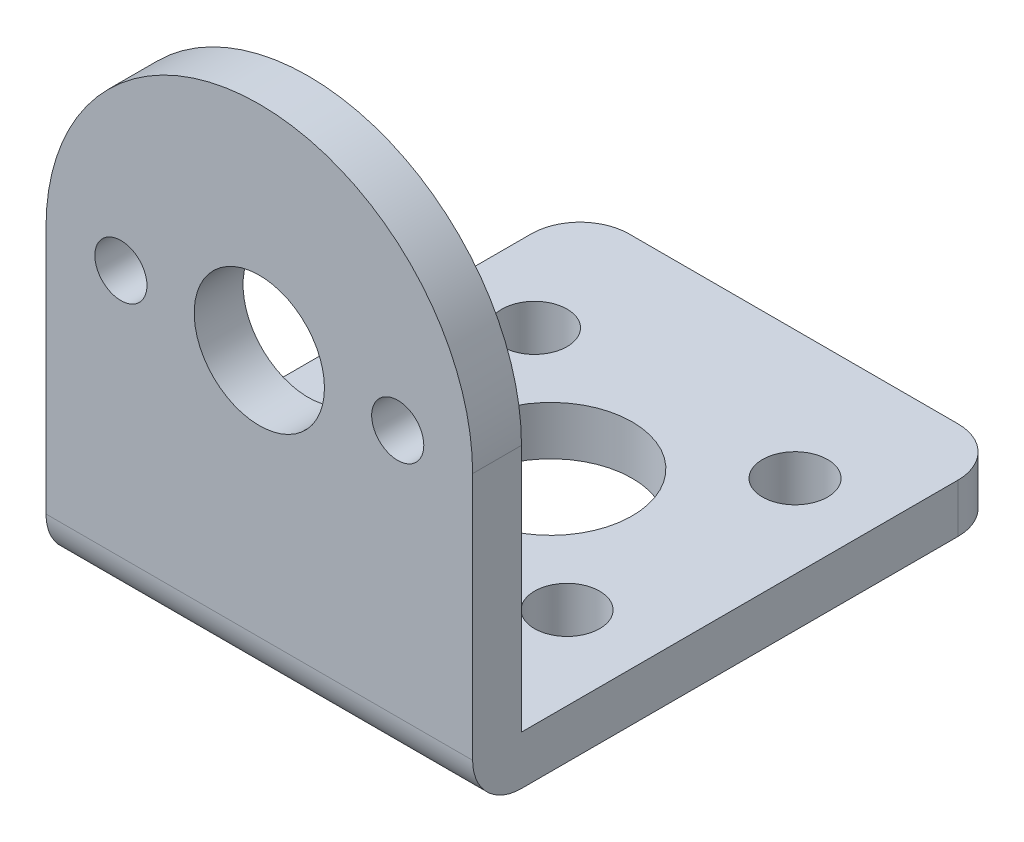
from build123d import *

# Parameters (mm, degrees)
SKETCH1_R            = 4
SKETCH1_R_2          = 1.6
JGA25_SCREWS_DEPTH   = 3
SKETCH2_W            = 26.2
SKETCH2_H            = 29.8
SKETCH2_R            = 5
SKETCH2_R_2          = 2
BRACKET_SCREWS_DEPTH = 3
L_SHAPE_FILLET_R     = 3
CORNER_FILLETS_R     = 3


with BuildPart() as part:
    # Sketch1 → JGA25-Screws (new body)
    with BuildSketch(Plane.XY):
        with BuildLine():
            Line((-13.1, 0), (-13.1, -18.25))
            Line((-13.1, -18.25), (13.1, -18.25))
            Line((13.1, -18.25), (13.1, 0))
            ThreePointArc((13.1, 0), (0, 13.1), (-13.1, 0))
        make_face()
        Circle(SKETCH1_R, mode=Mode.SUBTRACT)
        with Locations((-8.5, 0)):
            Circle(SKETCH1_R_2, mode=Mode.SUBTRACT)
        with Locations((8.5, 0)):
            Circle(SKETCH1_R_2, mode=Mode.SUBTRACT)
    extrude(amount=JGA25_SCREWS_DEPTH)

    # Sketch2 → Bracket-Screws (add)
    with BuildSketch(Plane.XZ.offset(18.25)):
        with Locations((0, -14.9)):
            Rectangle(SKETCH2_W, SKETCH2_H)
        with Locations(Location((0, -14.9, 0), (0, 0, 270))):
            Circle(SKETCH2_R, mode=Mode.SUBTRACT)
        with Locations(Location((8, -21.9, 0), (0, 0, 270))):
            Circle(SKETCH2_R_2, mode=Mode.SUBTRACT)
        with Locations(Location((-8, -21.9, 0), (0, 0, 270))):
            Circle(SKETCH2_R_2, mode=Mode.SUBTRACT)
        with Locations(Location((8, -7.9, 0), (0, 0, 270))):
            Circle(SKETCH2_R_2, mode=Mode.SUBTRACT)
        with Locations(Location((-8, -7.9, 0), (0, 0, 270))):
            Circle(SKETCH2_R_2, mode=Mode.SUBTRACT)
    extrude(amount=-BRACKET_SCREWS_DEPTH)

    # L-Shape-Fillet
    l_shape_fillet_edges = [part.edges().sort_by_distance(p)[0] for p in [
        (0, -18.25, 3),
    ]]
    fillet(l_shape_fillet_edges, radius=L_SHAPE_FILLET_R)

    # Corner-Fillets
    corner_fillets_edges = [part.edges().sort_by_distance(p)[0] for p in [
        (-13.1, -16.75, -29.8),
        (13.1, -16.75, -29.8),
    ]]
    fillet(corner_fillets_edges, radius=CORNER_FILLETS_R)


solid = part.part
